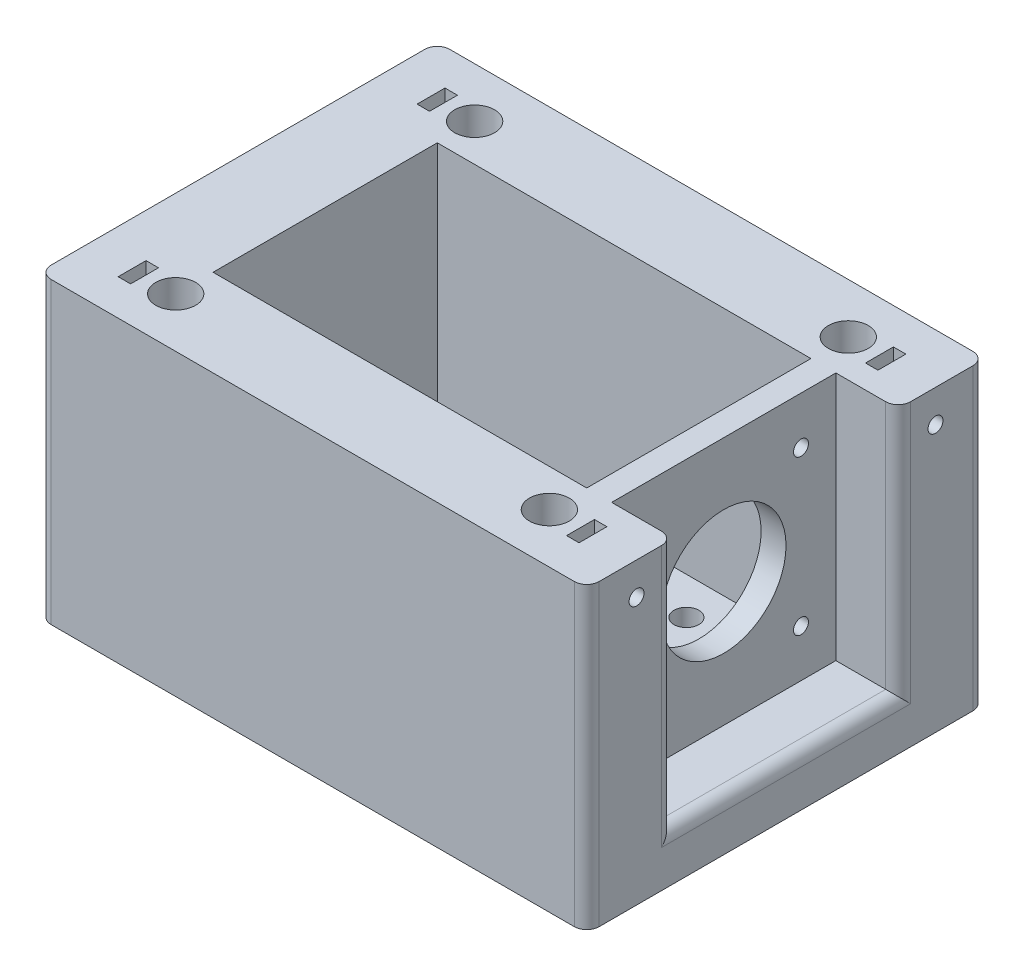
from build123d import *
from build123d.topology import SkipClean

# Parameters (mm, degrees)
SKETCH1_W           = 110
SKETCH1_H           = 80
BOSS_EXTRUDE1_DEPTH = 60
SKETCH2_W           = 75
SKETCH2_H           = 45
SKETCH2_W_2         = 12.5
CUT_EXTRUDE2_DEPTH  = 50
SKETCH4_W           = 1.25
SKETCH4_H           = 2.8
CUT_EXTRUDE3_DEPTH  = 10
SKETCH5_R           = 1.5
CUT_EXTRUDE4_DEPTH  = 117
SKETCH6_R           = 12.5
CUT_EXTRUDE5_DEPTH  = 5
FILLET1_R           = 2.5
SKETCH7_R           = 2.5
CUT_EXTRUDE6_DEPTH  = 10


with BuildPart() as part:
    # Sketch1 → Boss-Extrude1 (new body)
    with BuildSketch(Plane(origin=(0, 0, 0), x_dir=(1, 0, 0), z_dir=(0, 1, 0))):
        Rectangle(SKETCH1_W, SKETCH1_H)
    extrude(amount=BOSS_EXTRUDE1_DEPTH)

    # Sketch2 → Cut-Extrude2 (cut)
    with BuildSketch(Plane(origin=(0, 60, 0), x_dir=(1, 0, 0), z_dir=(0, 1, 0))):
        Rectangle(SKETCH2_W, SKETCH2_H)
        with BuildLine():
            ThreePointArc((-33.5, 30), (-40.328427125, 32.828427125), (-37.5, 26))
            Line((-37.5, 26), (-37.5, 30))
            Line((-37.5, 30), (-33.5, 30))
        make_face()
        with BuildLine():
            Line((-37.5, 30), (-37.5, 26))
            ThreePointArc((-37.5, 26), (-34.671572875, 27.171572875), (-33.5, 30))
            Line((-33.5, 30), (-37.5, 30))
        make_face()
        with BuildLine():
            ThreePointArc((33.5, 30), (34.671572875, 27.171572875), (37.5, 26))
            Line((37.5, 26), (37.5, 30))
            Line((37.5, 30), (33.5, 30))
        make_face()
        with BuildLine():
            Line((37.5, 30), (37.5, 26))
            ThreePointArc((37.5, 26), (40.328427125, 27.171572875), (41.5, 30))
            ThreePointArc((41.5, 30), (37.5, 34), (33.5, 30))
            Line((33.5, 30), (37.5, 30))
        make_face()
        with BuildLine():
            ThreePointArc((-33.5, -30), (-34.671572875, -27.171572875), (-37.5, -26))
            Line((-37.5, -26), (-37.5, -30))
            Line((-37.5, -30), (-33.5, -30))
        make_face()
        with BuildLine():
            Line((-37.5, -30), (-37.5, -26))
            ThreePointArc((-37.5, -26), (-40.328427125, -32.828427125), (-33.5, -30))
            Line((-33.5, -30), (-37.5, -30))
        make_face()
        with BuildLine():
            ThreePointArc((41.5, -30), (40.328427125, -27.171572875), (37.5, -26))
            Line((37.5, -26), (37.5, -30))
            Line((37.5, -30), (33.5, -30))
            ThreePointArc((33.5, -30), (37.5, -34), (41.5, -30))
        make_face()
        with BuildLine():
            Line((37.5, -30), (37.5, -26))
            ThreePointArc((37.5, -26), (34.671572875, -27.171572875), (33.5, -30))
            Line((33.5, -30), (37.5, -30))
        make_face()
        with Locations((48.75, 0)):
            Rectangle(SKETCH2_W_2, SKETCH2_H)
    extrude(amount=-CUT_EXTRUDE2_DEPTH, mode=Mode.SUBTRACT)

    # Sketch4 → Cut-Extrude3 (cut)
    with BuildSketch(Plane(origin=(0, 60, 0), x_dir=(1, 0, 0), z_dir=(0, 1, 0))):
        Polygon((-45, 27.2), (-45, 30), (-43.75, 30), (-43.75, 32.8), (-46.25, 32.8), (-46.25, 27.2), align=None)
        with Locations((-44.375, 28.6)):
            Rectangle(SKETCH4_W, SKETCH4_H)
        Polygon((-45, -30), (-45, -27.2), (-46.25, -27.2), (-46.25, -32.8), (-43.75, -32.8), (-43.75, -30), align=None)
        with Locations((-44.375, -28.6)):
            Rectangle(SKETCH4_W, SKETCH4_H)
        with Locations((44.375, -28.6)):
            Rectangle(SKETCH4_W, SKETCH4_H)
        Polygon((46.25, -27.2), (45, -27.2), (45, -30), (43.75, -30), (43.75, -32.8), (46.25, -32.8), align=None)
        Polygon((43.75, 32.8), (43.75, 30), (45, 30), (45, 27.2), (46.25, 27.2), (46.25, 32.8), align=None)
        with Locations((44.375, 28.6)):
            Rectangle(SKETCH4_W, SKETCH4_H)
    extrude(amount=-CUT_EXTRUDE3_DEPTH, mode=Mode.SUBTRACT)

    # Sketch5 → Cut-Extrude4 (cut)
    with SkipClean():  # the faces are left unmerged after this step: merging them gives an invalid solid
        with BuildSketch(Plane(origin=(55, 0, 0), x_dir=(0, 0, -1), z_dir=(1, 0, 0))):
            with Locations((-30, 53.5)):
                Circle(SKETCH5_R)
            with Locations((30, 53.5)):
                Circle(SKETCH5_R)
        extrude(amount=-CUT_EXTRUDE4_DEPTH, mode=Mode.SUBTRACT)

    # Sketch6 → Cut-Extrude5 (cut)
    with SkipClean():  # the faces are left unmerged after this step: merging them gives an invalid solid
        with BuildSketch(Plane(origin=(42.5, 0, 0), x_dir=(0, 0, -1), z_dir=(1, 0, 0))):
            with Locations((0, 35)):
                Circle(SKETCH6_R)
            with BuildLine():
                Line((-15.5, 49), (-15.5, 50.5))
                Line((-15.5, 50.5), (-14, 50.5))
                ThreePointArc((-14, 50.5), (-16.560660172, 51.560660172), (-15.5, 49))
            make_face()
            with BuildLine():
                Line((-14, 50.5), (-15.5, 50.5))
                Line((-15.5, 50.5), (-15.5, 49))
                ThreePointArc((-15.5, 49), (-14.439339828, 49.439339828), (-14, 50.5))
            make_face()
            with BuildLine():
                ThreePointArc((17, 50.5), (15.5, 52), (14, 50.5))
                Line((14, 50.5), (15.5, 50.5))
                Line((15.5, 50.5), (15.5, 49))
                ThreePointArc((15.5, 49), (16.560660172, 49.439339828), (17, 50.5))
            make_face()
            with BuildLine():
                Line((15.5, 50.5), (14, 50.5))
                ThreePointArc((14, 50.5), (14.439339828, 49.439339828), (15.5, 49))
                Line((15.5, 49), (15.5, 50.5))
            make_face()
            with BuildLine():
                ThreePointArc((17, 19.5), (16.560660172, 20.560660172), (15.5, 21))
                Line((15.5, 21), (15.5, 19.5))
                Line((15.5, 19.5), (14, 19.5))
                ThreePointArc((14, 19.5), (15.5, 18), (17, 19.5))
            make_face()
            with BuildLine():
                Line((15.5, 19.5), (15.5, 21))
                ThreePointArc((15.5, 21), (14.439339828, 20.560660172), (14, 19.5))
                Line((14, 19.5), (15.5, 19.5))
            make_face()
            with BuildLine():
                ThreePointArc((-14, 19.5), (-14.439339828, 20.560660172), (-15.5, 21))
                Line((-15.5, 21), (-15.5, 19.5))
                Line((-15.5, 19.5), (-14, 19.5))
            make_face()
            with BuildLine():
                Line((-15.5, 19.5), (-15.5, 21))
                ThreePointArc((-15.5, 21), (-16.560660172, 18.439339828), (-14, 19.5))
                Line((-14, 19.5), (-15.5, 19.5))
            make_face()
        extrude(amount=-CUT_EXTRUDE5_DEPTH, mode=Mode.SUBTRACT)

    # Fillet1
    fillet1_edges = [part.edges().sort_by_distance(p)[0] for p in [
        (55, 10, 0),
        (55, 35, -22.5),
        (55, 35, 22.5),
        (55, 30, 40),
        (-55, 30, 40),
        (-55, 30, -40),
        (55, 30, -40),
    ]]
    fillet(fillet1_edges, radius=FILLET1_R)

    # Sketch7 → Cut-Extrude6 (cut)
    with SkipClean():  # the faces are left unmerged after this step: merging them gives an invalid solid
        with BuildSketch(Plane(origin=(0, 10, 0), x_dir=(1, 0, 0), z_dir=(0, 1, 0))):
            with Locations(Location((-20, 15, 0), (0, 0, 270))):
                Circle(SKETCH7_R)
            with Locations(Location((20, 15, 0), (0, 0, 270))):
                Circle(SKETCH7_R)
            with Locations(Location((-20, -15, 0), (0, 0, 270))):
                Circle(SKETCH7_R)
            with Locations(Location((20, -15, 0), (0, 0, 270))):
                Circle(SKETCH7_R)
        extrude(amount=-CUT_EXTRUDE6_DEPTH, mode=Mode.SUBTRACT)


solid = part.part
